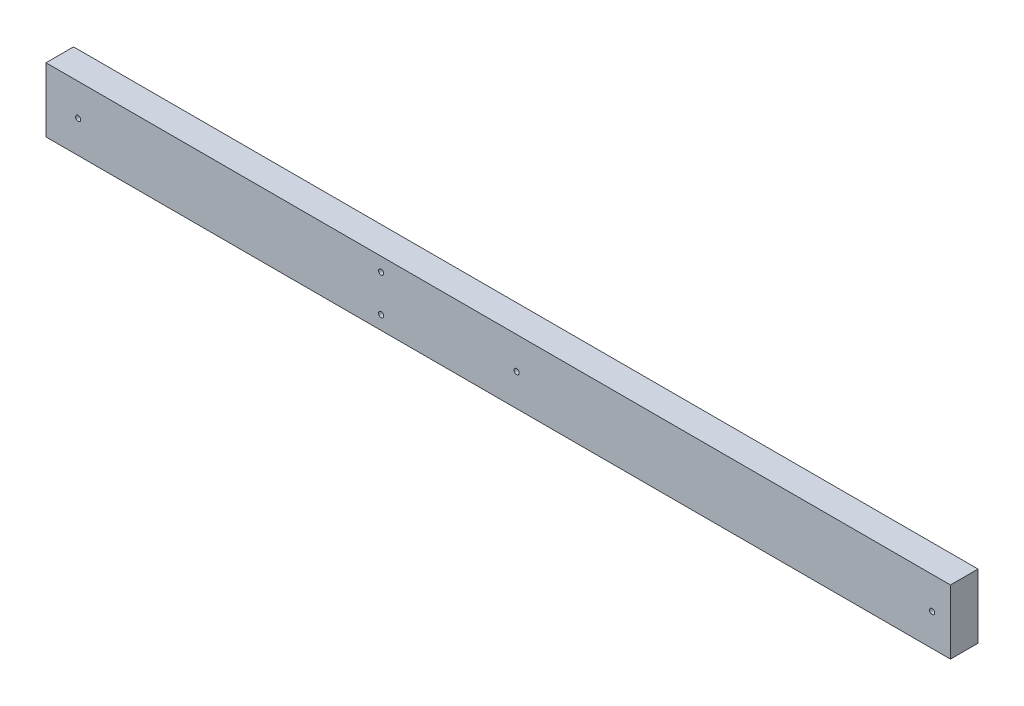
from build123d import *

# Parameters (mm, degrees)
SKETCH1_W           = 38.1
SKETCH1_H           = 88.9
BOSS_EXTRUDE1_DEPTH = 1250.95
SKETCH2_R           = 3.571875
CUT_EXTRUDE1_DEPTH  = 1255.683514875


with BuildPart() as part:
    # Sketch1 → Boss-Extrude1 (new body)
    with BuildSketch(Plane(origin=(0, 0, 0), x_dir=(0, 0, -1), z_dir=(1, 0, 0))):
        with Locations((19.05, 44.45)):
            Rectangle(SKETCH1_W, SKETCH1_H)
    extrude(amount=BOSS_EXTRUDE1_DEPTH)

    # Sketch2 → Cut-Extrude1 (cut, through all)
    with BuildSketch(Plane.XY):
        with Locations((44.45, 44.45)):
            Circle(SKETCH2_R)
        with Locations((1225.55, 44.45)):
            Circle(SKETCH2_R)
        with Locations((650.875, 44.45)):
            Circle(SKETCH2_R)
        with Locations((463.55, 19.05)):
            Circle(SKETCH2_R)
        with Locations((463.55, 69.85)):
            Circle(SKETCH2_R)
    extrude(amount=-CUT_EXTRUDE1_DEPTH, mode=Mode.SUBTRACT)


solid = part.part
